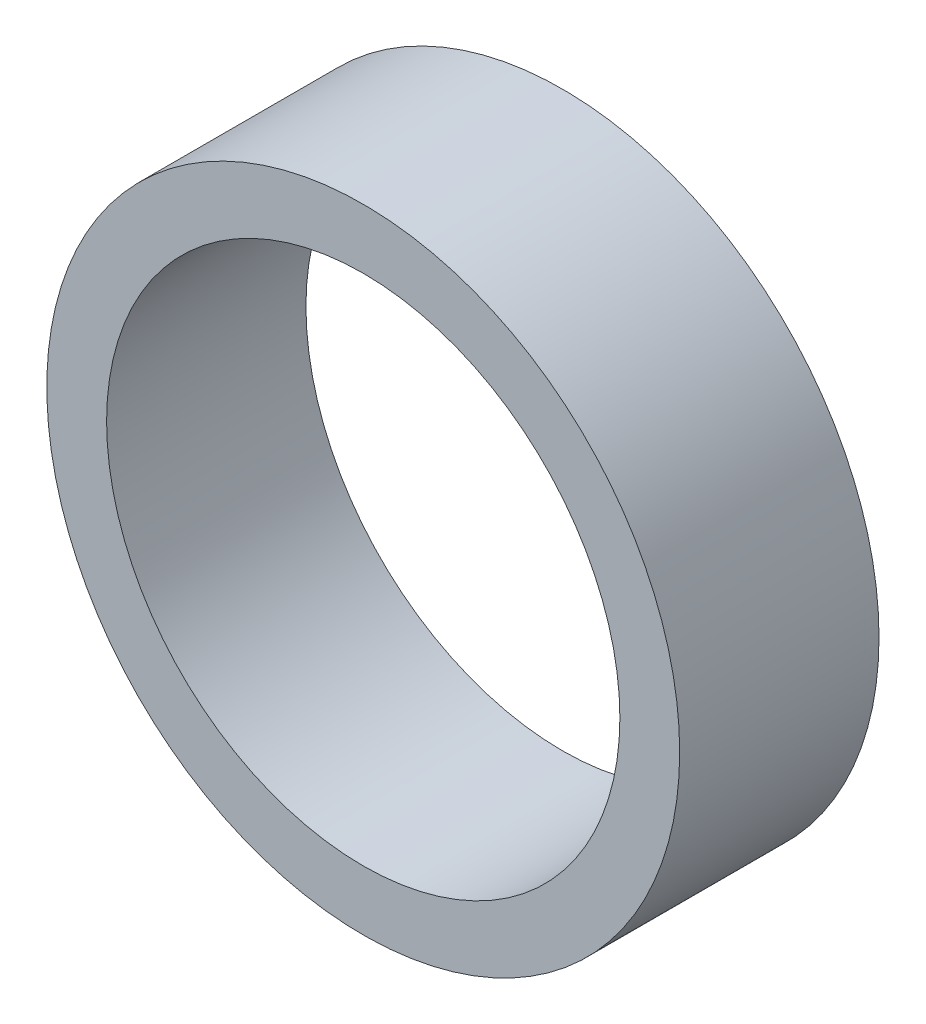
from build123d import *

# Parameters (mm, degrees)
ESBO_O1_R                = 6.35
ESBO_O1_R_2              = 5.15
RESSALTO_EXTRUS_O1_DEPTH = 4


with BuildPart() as part:
    # Esboço1 → Ressalto-extrusão1 (new body)
    with BuildSketch(Plane.XY):
        Circle(ESBO_O1_R)
        Circle(ESBO_O1_R_2, mode=Mode.SUBTRACT)
    extrude(amount=RESSALTO_EXTRUS_O1_DEPTH)


solid = part.part
